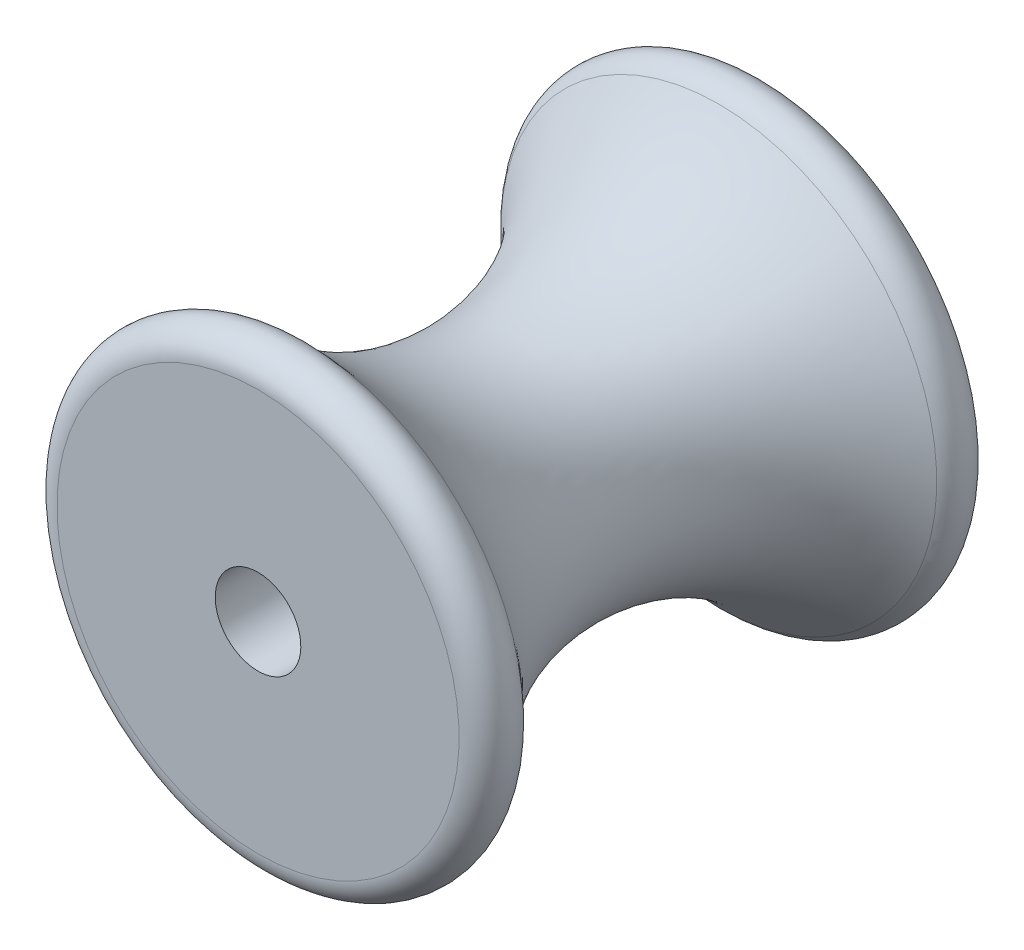
from build123d import *

# Parameters (mm, degrees)
FILLET1_R = 1


with BuildPart() as part:
    # Sketch1 → Revolve1 (revolve)
    with BuildSketch(Plane(origin=(0, 0, 0), x_dir=(0, 0, -1), z_dir=(1, 0, 0))):
        with BuildLine():
            Line((9.5, 1.6), (9.5, 11.377501001))
            ThreePointArc((9.5, 11.377501001), (0, 4.5), (-9.5, 11.377501001))
            Line((-9.5, 11.377501001), (-9.5, 1.6))
            Line((-9.5, 1.6), (9.5, 1.6))
        make_face()
    revolve(axis=Axis((0, 0, -10), (0, 0, 1)))

    # Fillet1
    fillet1_edges = [part.edges().sort_by_distance(p)[0] for p in [
        (0, -11.377501001, 9.5),
        (0, -11.377501001, -9.5),
    ]]
    fillet(fillet1_edges, radius=FILLET1_R)


solid = part.part
